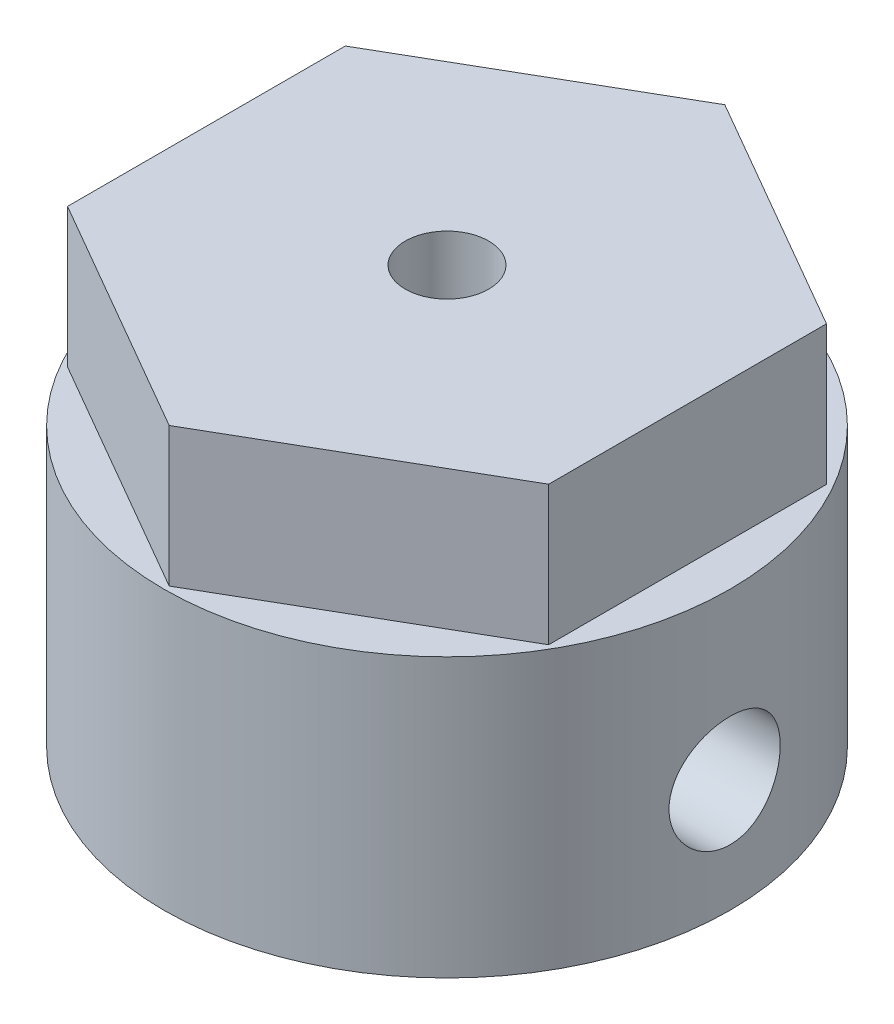
from build123d import *

# Parameters (mm, degrees)
SKETCH_1_R                           = 10.18
EXTRUDE_355_DEPTH                    = 10
EXTRUDE_479_DEPTH                    = 5
SKETCH_3_R                           = 2
CUT_EXTRUDE_578_DEPTH                = 8.6
SKETCH_4_W                           = 2.3
SKETCH_4_H                           = 7.5
CUT_EXTRUDE_807_DEPTH                = 8
SKETCH_5_R                           = 2
CUT_EXTRUDE_1_DEPTH                  = 23.923204401
CUT_EXTRUDE_1_DIRECTION_2_REACH      = 24.923
CUT_EXTRUDE_1_DIRECTION_2_END_RADIUS = 2
SKETCH_6_R                           = 2
CUT_EXTRUDE_2_DEPTH                  = 24.540700338
CUT_EXTRUDE_2_DIRECTION_2_REACH      = 25.541
CUT_EXTRUDE_2_DIRECTION_2_END_RADIUS = 2
CUT_EXTRUDE_1_2_DEPTH                = 2.3
CUT_EXTRUDE_2_2_DEPTH                = 2.3
SKETCH_9_R                           = 1.5
CUT_EXTRUDE_7_DEPTH                  = 21.790978983


with BuildPart() as part:
    # Эскиз1 → Extrude 355 (new body)
    with BuildSketch(Plane(origin=(0, 0, 0), x_dir=(1, 0, 0), z_dir=(0, 1, 0))):
        with Locations(Location((0, 0, 0), (0, 0, 270))):
            Circle(SKETCH_1_R)
    extrude(amount=EXTRUDE_355_DEPTH)

    # Эскиз2 → Extrude 479 (add)
    with BuildSketch(Plane(origin=(0, 10, 0), x_dir=(1, 0, 0), z_dir=(0, 1, 0))):
        Polygon((0, 9.988159657), (-8.65, 4.994079828), (-8.65, -4.994079828), (0, -9.988159657), (8.65, -4.994079828), (8.65, 4.994079828), align=None)
    extrude(amount=EXTRUDE_479_DEPTH)

    # Эскиз3 → Cut-Extrude 578 (cut)
    with BuildSketch(Plane.XZ):
        with Locations(Location((0, 0, 0), (0, 0, 270))):
            Circle(SKETCH_3_R)
    extrude(amount=-CUT_EXTRUDE_578_DEPTH, mode=Mode.SUBTRACT)

    # Эскиз4 → Cut-Extrude 807 (cut)
    with BuildSketch(Plane.XZ):
        Polygon((-5.172595264, -1.459197805), (1.322595264, -5.209197805), (0.172595264, -7.201056233), (-6.322595264, -3.451056233), align=None)
        with Locations((5, 0)):
            Rectangle(SKETCH_4_W, SKETCH_4_H)
    extrude(amount=-CUT_EXTRUDE_807_DEPTH, mode=Mode.SUBTRACT)

    # Эскиз5 → Cut-Extrude 1 (cut)
    with BuildSketch(Plane(origin=(3.85, 0, 0), x_dir=(0, 0, -1), z_dir=(1, 0, 0))):
        with Locations(Location((0, 4.041451884, 0), (0, 0, 270))):
            Circle(SKETCH_5_R)
    extrude(amount=CUT_EXTRUDE_1_DEPTH, mode=Mode.SUBTRACT)

    # Cut-Extrude 1 direction 2: up to this cylinder (the profile starts outside it)
    cut_extrude_1_direction_2_end = Plane(origin=(0, 4.041452, 0), z_dir=(0, -1, 0)) * Cylinder(CUT_EXTRUDE_1_DIRECTION_2_END_RADIUS, 54.846, mode=Mode.PRIVATE)
    # Эскиз5 → Cut-Extrude 1 direction 2 (cut, up to the surface)
    with BuildSketch(Plane(origin=(3.85, 0, 0), x_dir=(0, 0, -1), z_dir=(1, 0, 0)), mode=Mode.PRIVATE) as cut_extrude_1_direction_2_sk1:
        with Locations(Location((0, 4.041451884, 0), (0, 0, 270))):
            Circle(SKETCH_5_R)
    cut_extrude_1_direction_2_tool1 = extrude(cut_extrude_1_direction_2_sk1.sketch, amount=-CUT_EXTRUDE_1_DIRECTION_2_REACH, mode=Mode.PRIVATE) - cut_extrude_1_direction_2_end
    add(cut_extrude_1_direction_2_tool1.solids().sort_by_distance((3.85, 4.041452, 0))[0], mode=Mode.SUBTRACT)

    # Эскиз6 → Cut-Extrude 2 (cut)
    with BuildSketch(Plane(origin=(-1.925, 0, -3.334197805), x_dir=(-0.8660254037844363, 0, 0.5000000000000042), z_dir=(-0.5000000000000042, 0, -0.8660254037844363))):
        with Locations(Location((0, 4.041451884, 0), (0, 0, 180))):
            Circle(SKETCH_6_R)
    extrude(amount=CUT_EXTRUDE_2_DEPTH, mode=Mode.SUBTRACT)

    # Cut-Extrude 2 direction 2: up to this cylinder (the profile starts outside it)
    cut_extrude_2_direction_2_end = Plane(origin=(0, 4.041452, 0), z_dir=(0, -1, 0)) * Cylinder(CUT_EXTRUDE_2_DIRECTION_2_END_RADIUS, 56.082, mode=Mode.PRIVATE)
    # Эскиз6 → Cut-Extrude 2 direction 2 (cut, up to the surface)
    with BuildSketch(Plane(origin=(-1.925, 0, -3.334197805), x_dir=(-0.8660254037844363, 0, 0.5000000000000042), z_dir=(-0.5000000000000042, 0, -0.8660254037844363)), mode=Mode.PRIVATE) as cut_extrude_2_direction_2_sk1:
        with Locations(Location((0, 4.041451884, 0), (0, 0, 180))):
            Circle(SKETCH_6_R)
    cut_extrude_2_direction_2_tool1 = extrude(cut_extrude_2_direction_2_sk1.sketch, amount=-CUT_EXTRUDE_2_DIRECTION_2_REACH, mode=Mode.PRIVATE) - cut_extrude_2_direction_2_end
    add(cut_extrude_2_direction_2_tool1.solids().sort_by_distance((-1.925, 4.041452, -3.334198))[0], mode=Mode.SUBTRACT)

    # Эскиз7 → Cut-Extrude 1 2 (cut)
    with BuildSketch(Plane(origin=(3.85, 0, 0), x_dir=(0, 0, -1), z_dir=(1, 0, 0))):
        Polygon((-3.75, 1.876388375), (0, -0.288675135), (3.75, 1.876388375), (3.75, 6.206515394), (0, 8.371578903), (-3.75, 6.206515394), align=None)
    extrude(amount=CUT_EXTRUDE_1_2_DEPTH, mode=Mode.SUBTRACT)

    # Эскиз8 → Cut-Extrude 2 2 (cut)
    with BuildSketch(Plane(origin=(-1.925, 0, -3.334197805), x_dir=(-0.8660254037844363, 0, 0.5000000000000042), z_dir=(-0.5000000000000042, 0, -0.8660254037844363))):
        Polygon((0, 8.371578903), (-3.75, 6.206515394), (-3.75, 1.876388375), (0, -0.288675135), (3.75, 1.876388375), (3.75, 6.206515394), align=None)
    extrude(amount=CUT_EXTRUDE_2_2_DEPTH, mode=Mode.SUBTRACT)

    # Эскиз9 → Вырез-Вытянуть7 (cut, through all)
    with BuildSketch(Plane(origin=(0, 15, 0), x_dir=(1, 0, 0), z_dir=(0, 1, 0))):
        with Locations(Location((0, 0, 0), (0, 0, 270))):
            Circle(SKETCH_9_R)
    extrude(amount=-CUT_EXTRUDE_7_DEPTH, mode=Mode.SUBTRACT)


solid = part.part
